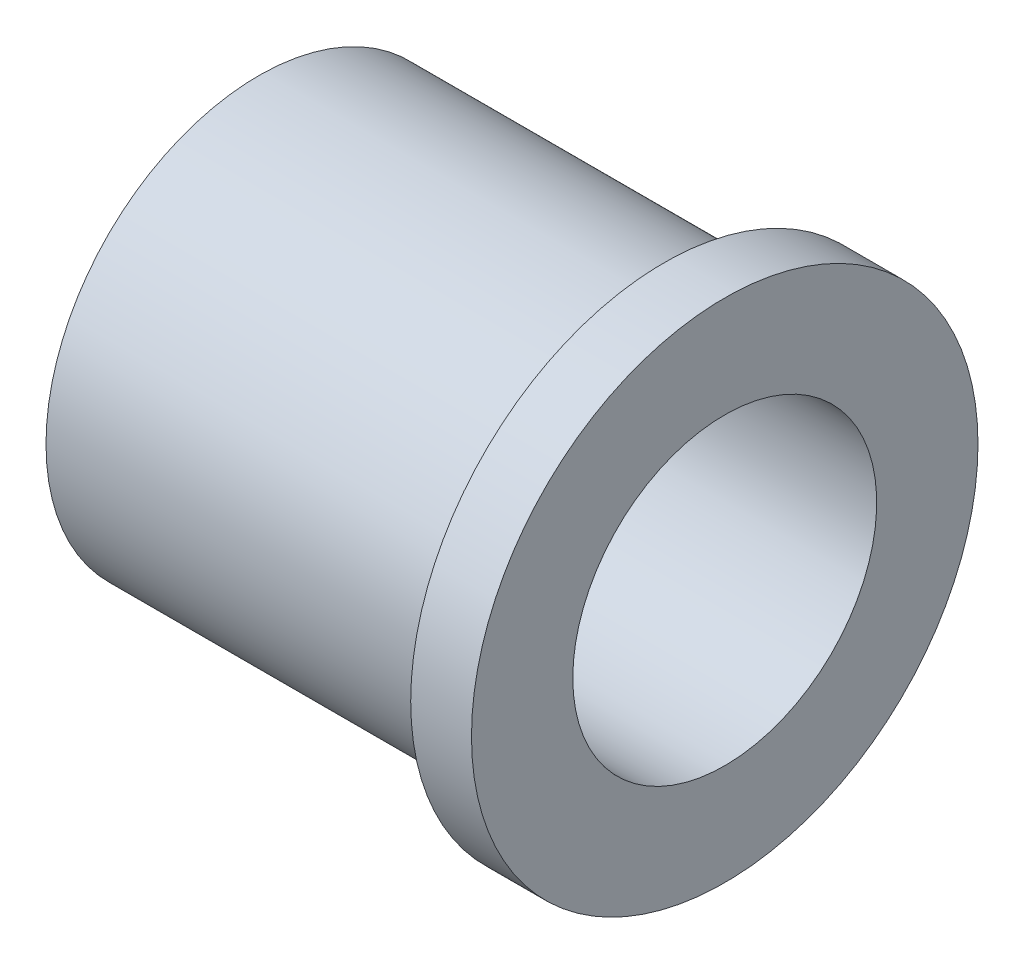
from build123d import *


with BuildPart() as part:
    # Sketch1 → Revolve1 (revolve)
    with BuildSketch(Plane.XY, mode=Mode.PRIVATE) as revolve1_sk:
        Polygon((0, 5.25), (0, 3.75), (11.5, 3.75), (11.5, 6.25), (10, 6.25), (10, 5.25), align=None)
    revolve(revolve1_sk.sketch.rotate(Axis((0, 0, 0), (1, 0, 0)), 90), axis=Axis((0, 0, 0), (1, 0, 0)))


solid = part.part
